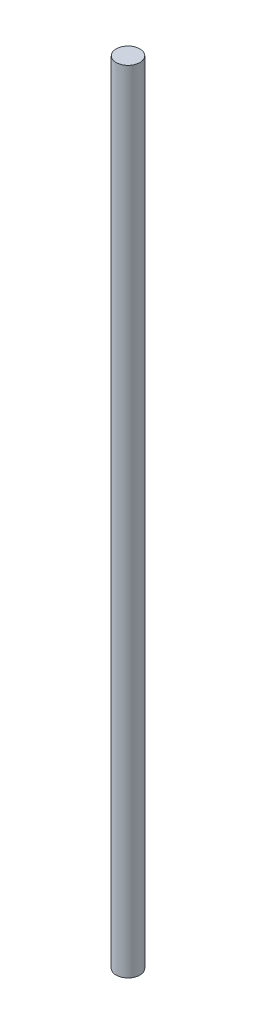
from build123d import *

# Parameters (mm, degrees)
BASE_OUTLINE_SKETCH_R = 1.5
BASE_OUTLINE_DEPTH    = 100


with BuildPart() as part:
    # Base Outline Sketch → Base Outline (new body)
    with BuildSketch(Plane(origin=(0, -165.1, 0), x_dir=(1, 0, 0), z_dir=(0, 1, 0))):
        with Locations(Location((-56.291651246, -50, 0), (0, 0, 270))):
            Circle(BASE_OUTLINE_SKETCH_R)
    extrude(amount=BASE_OUTLINE_DEPTH)


solid = part.part
